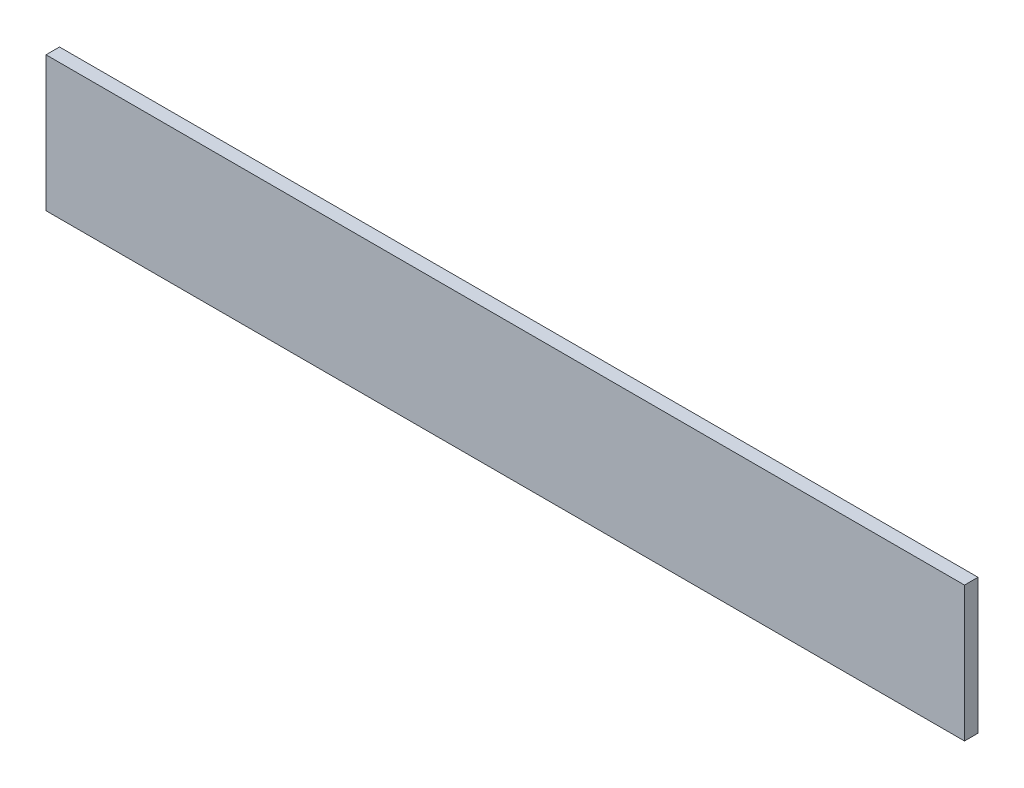
from build123d import *

# Parameters (mm, degrees)
ESQUISSE1_W        = 680
ESQUISSE1_H        = 100
BOSS_EXTRU_1_DEPTH = 10


with BuildPart() as part:
    # Esquisse1 → Boss.-Extru.1 (new body)
    with BuildSketch(Plane.XY):
        with Locations((-340, 50)):
            Rectangle(ESQUISSE1_W, ESQUISSE1_H)
    extrude(amount=BOSS_EXTRU_1_DEPTH)


solid = part.part
